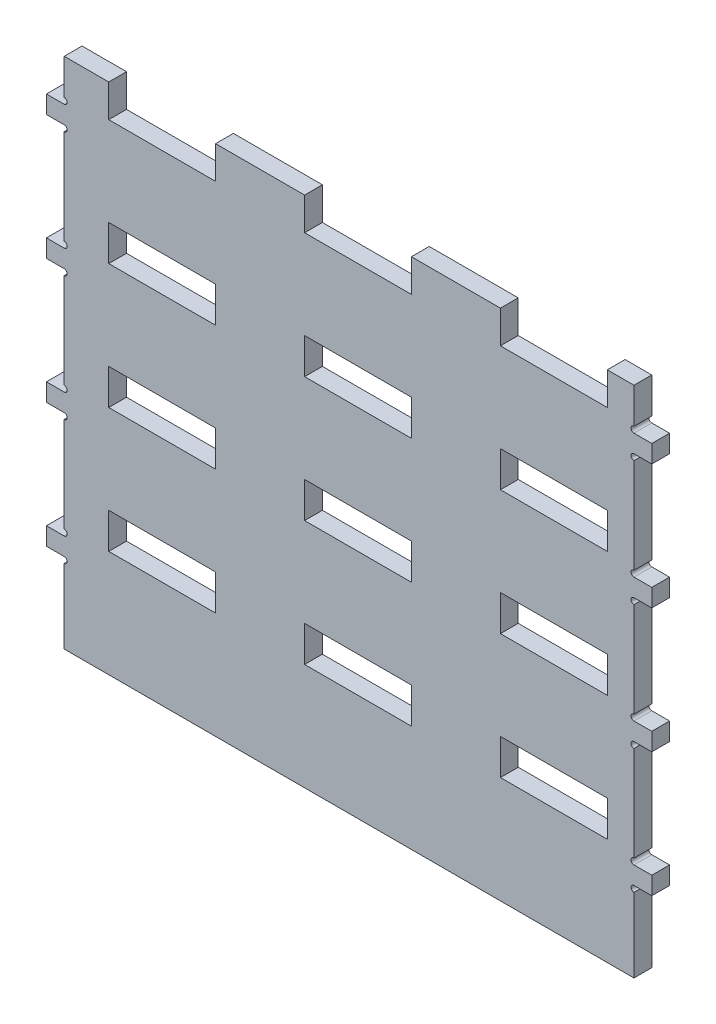
from build123d import *

# Parameters (mm, degrees)
SKETCH8_W           = 114.3
SKETCH8_H           = 38.1
BOSS_EXTRUDE3_DEPTH = 19.05


with BuildPart() as part:
    # Sketch8 → Boss-Extrude3 (new body)
    with BuildSketch(Plane.XY):
        with BuildLine():
            Line((-257.351483657, 282.913503235), (-304.976483657, 282.913503235))
            Line((-304.976483657, 282.913503235), (-304.976483657, 244.813503235))
            ThreePointArc((-304.976483657, 244.813503235), (-301.801483657, 241.638503235), (-304.976483657, 238.463503235))
            Line((-304.976483657, 238.463503235), (-324.026483657, 238.463503235))
            Line((-324.026483657, 238.463503235), (-324.026483657, 219.413503235))
            Line((-324.026483657, 219.413503235), (-304.976483657, 219.413503235))
            ThreePointArc((-304.976483657, 219.413503235), (-301.801483657, 216.238503235), (-304.976483657, 213.063503235))
            Line((-304.976483657, 213.063503235), (-304.976483657, 111.463503235))
            ThreePointArc((-304.976483657, 111.463503235), (-301.801483657, 108.288503235), (-304.976483657, 105.113503235))
            Line((-304.976483657, 105.113503235), (-324.026483657, 105.113503235))
            Line((-324.026483657, 105.113503235), (-324.026483657, 86.063503235))
            Line((-324.026483657, 86.063503235), (-304.976483657, 86.063503235))
            ThreePointArc((-304.976483657, 86.063503235), (-301.801483657, 82.888503235), (-304.976483657, 79.713503235))
            Line((-304.976483657, 79.713503235), (-304.976483657, -21.886496765))
            ThreePointArc((-304.976483657, -21.886496765), (-301.801483657, -25.061496765), (-304.976483657, -28.236496765))
            Line((-304.976483657, -28.236496765), (-324.026483657, -28.236496765))
            Line((-324.026483657, -28.236496765), (-324.026483657, -47.286496765))
            Line((-324.026483657, -47.286496765), (-304.976483657, -47.286496765))
            ThreePointArc((-304.976483657, -47.286496765), (-301.801483657, -50.461496765), (-304.976483657, -53.636496765))
            Line((-304.976483657, -53.636496765), (-304.976483657, -155.236496765))
            ThreePointArc((-304.976483657, -155.236496765), (-301.801483657, -158.411496765), (-304.976483657, -161.586496765))
            Line((-304.976483657, -161.586496765), (-324.026483657, -161.586496765))
            Line((-324.026483657, -161.586496765), (-324.026483657, -180.636496765))
            Line((-324.026483657, -180.636496765), (-304.976483657, -180.636496765))
            ThreePointArc((-304.976483657, -180.636496765), (-301.801483657, -183.811496765), (-304.976483657, -186.986496765))
            Line((-304.976483657, -186.986496765), (-304.976483657, -266.361496765))
            Line((-304.976483657, -266.361496765), (304.623516343, -266.361496765))
            Line((304.623516343, -266.361496765), (304.623516343, -186.986496765))
            ThreePointArc((304.623516343, -186.986496765), (301.448516343, -183.811496765), (304.623516343, -180.636496765))
            Line((304.623516343, -180.636496765), (323.673516343, -180.636496765))
            Line((323.673516343, -180.636496765), (323.673516343, -161.586496765))
            Line((323.673516343, -161.586496765), (304.623516343, -161.586496765))
            ThreePointArc((304.623516343, -161.586496765), (301.448516343, -158.411496765), (304.623516343, -155.236496765))
            Line((304.623516343, -155.236496765), (304.623516343, -53.636496765))
            ThreePointArc((304.623516343, -53.636496765), (301.448516343, -50.461496765), (304.623516343, -47.286496765))
            Line((304.623516343, -47.286496765), (323.673516343, -47.286496765))
            Line((323.673516343, -47.286496765), (323.673516343, -28.236496765))
            Line((323.673516343, -28.236496765), (304.623516343, -28.236496765))
            ThreePointArc((304.623516343, -28.236496765), (301.448516343, -25.061496765), (304.623516343, -21.886496765))
            Line((304.623516343, -21.886496765), (304.623516343, 79.713503235))
            ThreePointArc((304.623516343, 79.713503235), (301.448516343, 82.888503235), (304.623516343, 86.063503235))
            Line((304.623516343, 86.063503235), (323.673516343, 86.063503235))
            Line((323.673516343, 86.063503235), (323.673516343, 105.113503235))
            Line((323.673516343, 105.113503235), (304.623516343, 105.113503235))
            ThreePointArc((304.623516343, 105.113503235), (301.448516343, 108.288503235), (304.623516343, 111.463503235))
            Line((304.623516343, 111.463503235), (304.623516343, 213.063503235))
            ThreePointArc((304.623516343, 213.063503235), (301.448516343, 216.238503235), (304.623516343, 219.413503235))
            Line((304.623516343, 219.413503235), (323.673516343, 219.413503235))
            Line((323.673516343, 219.413503235), (323.673516343, 238.463503235))
            Line((323.673516343, 238.463503235), (304.623516343, 238.463503235))
            ThreePointArc((304.623516343, 238.463503235), (301.448516343, 241.638503235), (304.623516343, 244.813503235))
            Line((304.623516343, 244.813503235), (304.623516343, 282.913503235))
            Line((304.623516343, 282.913503235), (276.048516343, 282.913503235))
            Line((276.048516343, 282.913503235), (276.048516343, 247.988503235))
            Line((276.048516343, 247.988503235), (161.748516343, 247.988503235))
            Line((161.748516343, 247.988503235), (161.748516343, 282.913503235))
            Line((161.748516343, 282.913503235), (66.498516343, 282.913503235))
            Line((66.498516343, 282.913503235), (66.498516343, 247.988503235))
            Line((66.498516343, 247.988503235), (-47.801483657, 247.988503235))
            Line((-47.801483657, 247.988503235), (-47.801483657, 282.913503235))
            Line((-47.801483657, 282.913503235), (-143.051483657, 282.913503235))
            Line((-143.051483657, 282.913503235), (-143.051483657, 247.988503235))
            Line((-143.051483657, 247.988503235), (-257.351483657, 247.988503235))
            Line((-257.351483657, 247.988503235), (-257.351483657, 282.913503235))
        make_face()
        with Locations((-200.201483657, -133.011496765)):
            Rectangle(SKETCH8_W, SKETCH8_H, mode=Mode.SUBTRACT)
        with Locations((-200.201483657, 0.338503235)):
            Rectangle(SKETCH8_W, SKETCH8_H, mode=Mode.SUBTRACT)
        with Locations((9.348516343, -133.011496765)):
            Rectangle(SKETCH8_W, SKETCH8_H, mode=Mode.SUBTRACT)
        with Locations((218.898516343, -133.011496765)):
            Rectangle(SKETCH8_W, SKETCH8_H, mode=Mode.SUBTRACT)
        with Locations((9.348516343, 0.338503235)):
            Rectangle(SKETCH8_W, SKETCH8_H, mode=Mode.SUBTRACT)
        with Locations((218.898516343, 0.338503235)):
            Rectangle(SKETCH8_W, SKETCH8_H, mode=Mode.SUBTRACT)
        with Locations((-200.201483657, 133.688503235)):
            Rectangle(SKETCH8_W, SKETCH8_H, mode=Mode.SUBTRACT)
        with Locations((9.348516343, 133.688503235)):
            Rectangle(SKETCH8_W, SKETCH8_H, mode=Mode.SUBTRACT)
        with Locations((218.898516343, 133.688503235)):
            Rectangle(SKETCH8_W, SKETCH8_H, mode=Mode.SUBTRACT)
    extrude(amount=BOSS_EXTRUDE3_DEPTH)


solid = part.part
